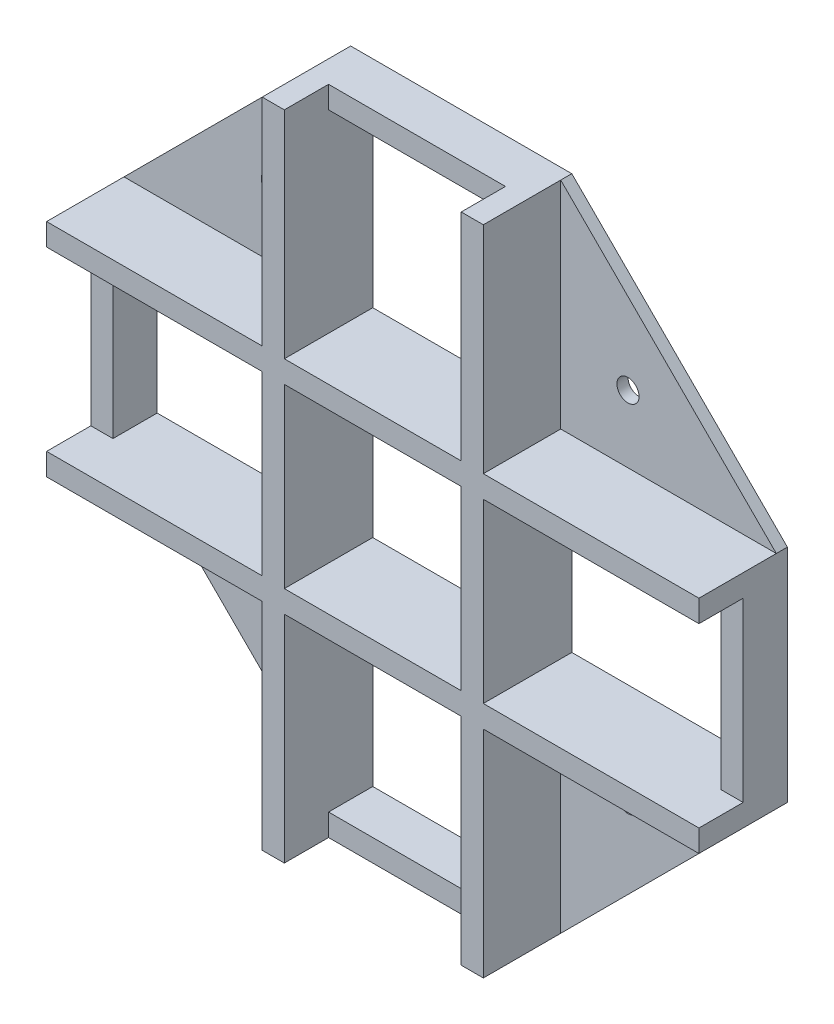
from build123d import *

# Parameters (mm, degrees)
SKETCH1_W           = 24.765
SKETCH1_H           = 25.4
SKETCH1_W_2         = 25.4
SKETCH1_H_2         = 24.765
BOSS_EXTRUDE1_DEPTH = 10.16
SKETCH2_W           = 20.32
SKETCH2_H           = 20.32
SKETCH2_H_2         = 22.225
SKETCH2_W_2         = 22.225
CUT_EXTRUDE1_DEPTH  = 10.16
SKETCH4_W           = 20.32
SKETCH4_H           = 2.54
SKETCH4_W_2         = 2.54
SKETCH4_H_2         = 20.32
CUT_EXTRUDE2_DEPTH  = 5.08
BOSS_EXTRUDE2_DEPTH = 1.27
SKETCH6_R           = 1.27
CUT_EXTRUDE3_DEPTH  = 1.27


with BuildPart() as part:
    # Sketch1 → Boss-Extrude1 (new body)
    with BuildSketch(Plane.XY):
        with Locations((-25.0825, 0)):
            Rectangle(SKETCH1_W, SKETCH1_H)
        Rectangle(SKETCH1_W_2, SKETCH1_H)
        with Locations((0, 25.0825)):
            Rectangle(SKETCH1_W_2, SKETCH1_H_2)
        with Locations((25.0825, 0)):
            Rectangle(SKETCH1_W, SKETCH1_H)
        with Locations((0, -25.0825)):
            Rectangle(SKETCH1_W_2, SKETCH1_H_2)
    extrude(amount=BOSS_EXTRUDE1_DEPTH)

    # Sketch2 → Cut-Extrude1 (cut)
    with BuildSketch(Plane.XY.offset(10.16)):
        Rectangle(SKETCH2_W, SKETCH2_H)
        with Locations((0, 23.8125)):
            Rectangle(SKETCH2_W, SKETCH2_H_2)
        with Locations((0, -23.8125)):
            Rectangle(SKETCH2_W, SKETCH2_H_2)
        with Locations((-23.8125, 0)):
            Rectangle(SKETCH2_W_2, SKETCH2_H)
        with Locations((23.8125, 0)):
            Rectangle(SKETCH2_W_2, SKETCH2_H)
    extrude(amount=-CUT_EXTRUDE1_DEPTH, mode=Mode.SUBTRACT)

    # Sketch4 → Cut-Extrude2 (cut)
    with BuildSketch(Plane.XY.offset(10.16)):
        with Locations((0, 36.195)):
            Rectangle(SKETCH4_W, SKETCH4_H)
        with Locations((36.195, 0)):
            Rectangle(SKETCH4_W_2, SKETCH4_H_2)
        with Locations((-36.195, 0)):
            Rectangle(SKETCH4_W_2, SKETCH4_H_2)
        with Locations((0, -36.195)):
            Rectangle(SKETCH4_W, SKETCH4_H)
    extrude(amount=-CUT_EXTRUDE2_DEPTH, mode=Mode.SUBTRACT)

    # Sketch5 → Boss-Extrude2 (add)
    with BuildSketch(Plane.XY):
        Polygon((-37.465, 12.7), (-12.7, 37.465), (-12.7, 12.7), align=None)
        Polygon((12.7, 37.465), (37.465, 12.7), (12.7, 12.7), align=None)
        Polygon((37.465, -12.7), (12.7, -12.7), (12.7, -37.465), align=None)
        Polygon((-12.7, -37.465), (-12.7, -12.7), (-37.465, -12.7), align=None)
    extrude(amount=BOSS_EXTRUDE2_DEPTH)

    # Sketch6 → Cut-Extrude3 (cut)
    with BuildSketch(Plane.XY.offset(1.27)):
        with Locations((-20.425141584, 20.425141584)):
            Circle(SKETCH6_R)
        with Locations((20.425141584, 20.425141584)):
            Circle(SKETCH6_R)
        with Locations(Location((20.425141584, -20.425141584, 0), (0, 0, 180))):
            Circle(SKETCH6_R)
        with Locations(Location((-20.425141584, -20.425141584, 0), (0, 0, 180))):
            Circle(SKETCH6_R)
    extrude(amount=-CUT_EXTRUDE3_DEPTH, mode=Mode.SUBTRACT)


solid = part.part
